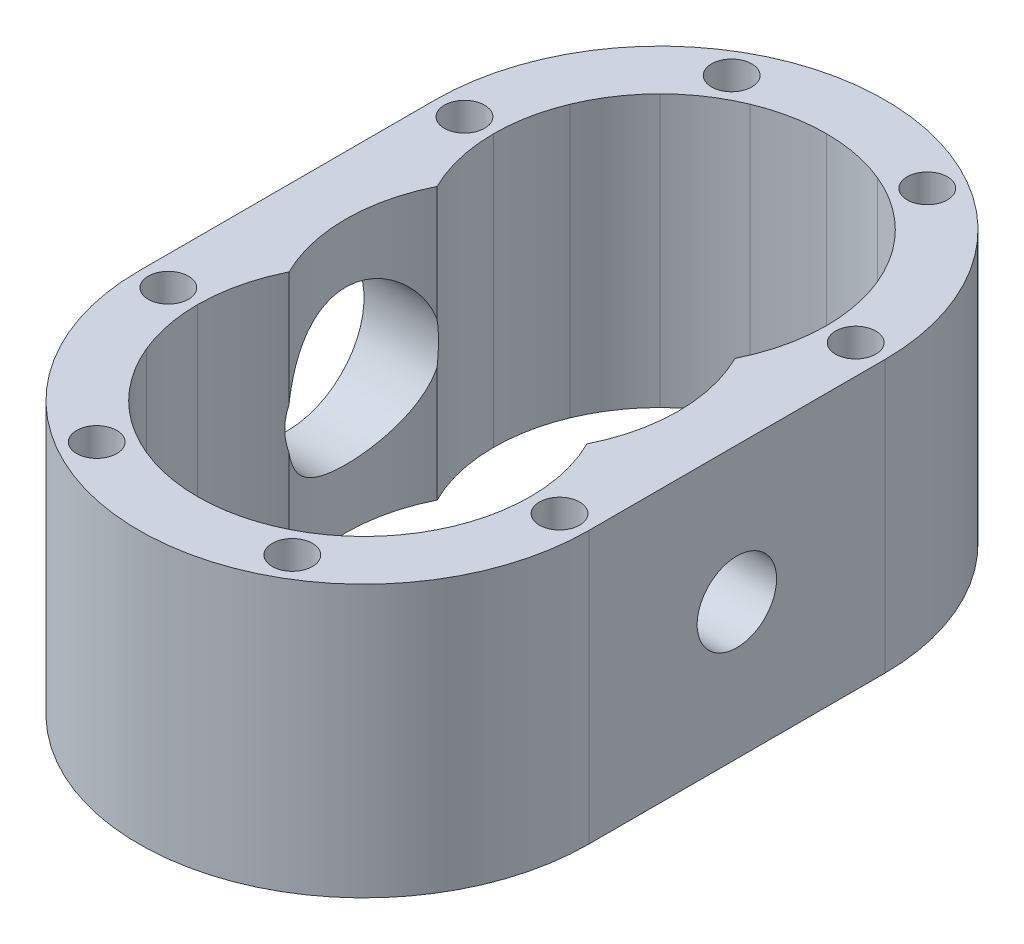
from build123d import *

# Parameters (mm, degrees)
Y_KSEKLIK_EKSTR_ZYON1_DEPTH = 37.15
KES_EKSTR_ZYON1_DEPTH       = 74.3
IZIM3_R                     = 5.5
KES_EKSTR_ZYON2_DEPTH       = 12
DAIRESEL_KAPLAMA1_COUNT     = 5
DAIRESEL_KAPLAMA1_ANGLE     = 240
AYNALAMA1_COPY_1_SKETCH_R   = 5.5
AYNALAMA1_COPY_1_DEPTH      = 12
AYNALAMA1_COPY_2_SKETCH_R   = 5.5
AYNALAMA1_COPY_2_DEPTH      = 12
AYNALAMA1_COPY_3_SKETCH_R   = 5.5
AYNALAMA1_COPY_3_DEPTH      = 12
AYNALAMA1_COPY_4_SKETCH_R   = 5.5
AYNALAMA1_COPY_4_DEPTH      = 12
AYNALAMA2_COPY_1_SKETCH_R   = 5.5
AYNALAMA2_COPY_1_DEPTH      = 12
AYNALAMA2_COPY_2_SKETCH_R   = 5.5
AYNALAMA2_COPY_2_DEPTH      = 12
AYNALAMA2_COPY_3_SKETCH_R   = 5.5
AYNALAMA2_COPY_3_DEPTH      = 12
AYNALAMA2_COPY_4_SKETCH_R   = 5.5
AYNALAMA2_COPY_4_DEPTH      = 12
AYNALAMA2_COPY_5_SKETCH_R   = 5.5
AYNALAMA2_COPY_5_DEPTH      = 12
AYNALAMA2_COPY_6_SKETCH_R   = 5.5
AYNALAMA2_COPY_6_DEPTH      = 12
AYNALAMA2_COPY_7_SKETCH_R   = 5.5
AYNALAMA2_COPY_7_DEPTH      = 12
AYNALAMA2_COPY_8_SKETCH_R   = 5.5
AYNALAMA2_COPY_8_DEPTH      = 12
AYNALAMA2_COPY_9_SKETCH_R   = 5.5
AYNALAMA2_COPY_9_DEPTH      = 12
KES_EKSTR_ZYON3_REACH       = 166.052
KES_EKSTR_ZYON3_END_RADIUS  = 45.5
IZIM4_R                     = 21.03
KES_EKSTR_ZYON4_REACH       = 166.052
KES_EKSTR_ZYON4_END_RADIUS  = 45.5
IZIM5_R                     = 10.86


with BuildPart() as part:
    # Çizim1 → Yükseklik-Ekstrüzyon1 (new, symmetric)
    with BuildSketch(Plane(origin=(0, 0, 0), x_dir=(1, 0, 0), z_dir=(0, 1, 0))):
        with BuildLine():
            Line((61.5, 40.5), (61.5, -40.5))
            ThreePointArc((61.5, -40.5), (0, -102), (-61.5, -40.5))
            Line((-61.5, -40.5), (-61.5, 40.5))
            ThreePointArc((-61.5, 40.5), (0, 102), (61.5, 40.5))
        make_face()
    extrude(amount=Y_KSEKLIK_EKSTR_ZYON1_DEPTH, both=True)

    # Çizim2 → Kes-Ekstrüzyon1 (cut)
    with BuildSketch(Plane(origin=(0, 37.15, 0), x_dir=(1, 0, 0), z_dir=(0, 1, 0))):
        with BuildLine():
            ThreePointArc((40.745398513, 20.25), (0, 86), (-40.745398513, 20.25))
            ThreePointArc((-40.745398513, 20.25), (-45.5, 0), (-40.745398513, -20.25))
            ThreePointArc((-40.745398513, -20.25), (0, -86), (40.745398513, -20.25))
            ThreePointArc((40.745398513, -20.25), (45.5, 0), (40.745398513, 20.25))
        make_face()
    extrude(amount=-KES_EKSTR_ZYON1_DEPTH, mode=Mode.SUBTRACT)

    # Çizim3 → Kes-Ekstrüzyon2 (cut)
    with BuildSketch(Plane(origin=(0, 37.15, 0), x_dir=(1, 0, 0), z_dir=(0, 1, 0))):
        with Locations(Location((-53.5, 40.5, 0), (0, 0, 270))):
            Circle(IZIM3_R)
    kes_ekstr_zyon2 = extrude(amount=-KES_EKSTR_ZYON2_DEPTH, mode=Mode.SUBTRACT)

    # Dairesel Kaplama1: Kes-Ekstrüzyon2 ×5 about axis
    dairesel_kaplama1_axis = Axis((0, 0, -40.5), (0, -1, 0))
    for i in range(1, DAIRESEL_KAPLAMA1_COUNT):
        add(kes_ekstr_zyon2.rotate(dairesel_kaplama1_axis, i * DAIRESEL_KAPLAMA1_ANGLE / (DAIRESEL_KAPLAMA1_COUNT - 1)), mode=Mode.SUBTRACT)

    # Aynalama1: Kes-Ekstrüzyon2 across plane
    add(kes_ekstr_zyon2.mirror(Plane.XY), mode=Mode.SUBTRACT)

    # Aynalama1 copy 1 sketch → Aynalama1 copy 1 (cut)
    with BuildSketch(Plane(origin=(-35.074028853, 37.15, 20.25), x_dir=(0.4999999999999978, 0, -0.8660254037844399), z_dir=(0, 1, 0))):
        with Locations((-53.5, -40.5)):
            Circle(AYNALAMA1_COPY_1_SKETCH_R)
    extrude(amount=-AYNALAMA1_COPY_1_DEPTH, mode=Mode.SUBTRACT)

    # Aynalama1 copy 2 sketch → Aynalama1 copy 2 (cut)
    with BuildSketch(Plane(origin=(-35.074028853, 37.15, 60.75), x_dir=(-0.5000000000000044, 0, -0.866025403784436), z_dir=(0, 1, 0))):
        with Locations((-53.5, -40.5)):
            Circle(AYNALAMA1_COPY_2_SKETCH_R)
    extrude(amount=-AYNALAMA1_COPY_2_DEPTH, mode=Mode.SUBTRACT)

    # Aynalama1 copy 3 sketch → Aynalama1 copy 3 (cut)
    with BuildSketch(Plane(origin=(0, 37.15, 81), x_dir=(-1, 0, 0), z_dir=(0, 1, 0))):
        with Locations((-53.5, -40.5)):
            Circle(AYNALAMA1_COPY_3_SKETCH_R)
    extrude(amount=-AYNALAMA1_COPY_3_DEPTH, mode=Mode.SUBTRACT)

    # Aynalama1 copy 4 sketch → Aynalama1 copy 4 (cut)
    with BuildSketch(Plane(origin=(35.074028853, 37.15, 60.75), x_dir=(-0.4999999999999912, 0, 0.8660254037844437), z_dir=(0, 1, 0))):
        with Locations((-53.5, -40.5)):
            Circle(AYNALAMA1_COPY_4_SKETCH_R)
    extrude(amount=-AYNALAMA1_COPY_4_DEPTH, mode=Mode.SUBTRACT)

    # Aynalama2: Kes-Ekstrüzyon2 across plane
    add(kes_ekstr_zyon2.mirror(Plane.ZX), mode=Mode.SUBTRACT)

    # Aynalama2 copy 1 sketch → Aynalama2 copy 1 (cut)
    with BuildSketch(Plane(origin=(-35.074028853, -37.15, -20.25), x_dir=(0.4999999999999978, 0, 0.8660254037844399), z_dir=(0, -1, 0))):
        with Locations((-53.5, -40.5)):
            Circle(AYNALAMA2_COPY_1_SKETCH_R)
    extrude(amount=-AYNALAMA2_COPY_1_DEPTH, mode=Mode.SUBTRACT)

    # Aynalama2 copy 2 sketch → Aynalama2 copy 2 (cut)
    with BuildSketch(Plane(origin=(-35.074028853, -37.15, -60.75), x_dir=(-0.5000000000000044, 0, 0.866025403784436), z_dir=(0, -1, 0))):
        with Locations((-53.5, -40.5)):
            Circle(AYNALAMA2_COPY_2_SKETCH_R)
    extrude(amount=-AYNALAMA2_COPY_2_DEPTH, mode=Mode.SUBTRACT)

    # Aynalama2 copy 3 sketch → Aynalama2 copy 3 (cut)
    with BuildSketch(Plane(origin=(0, -37.15, -81), x_dir=(-1, 0, 0), z_dir=(0, -1, 0))):
        with Locations((-53.5, -40.5)):
            Circle(AYNALAMA2_COPY_3_SKETCH_R)
    extrude(amount=-AYNALAMA2_COPY_3_DEPTH, mode=Mode.SUBTRACT)

    # Aynalama2 copy 4 sketch → Aynalama2 copy 4 (cut)
    with BuildSketch(Plane(origin=(35.074028853, -37.15, -60.75), x_dir=(-0.4999999999999912, 0, -0.8660254037844437), z_dir=(0, -1, 0))):
        with Locations((-53.5, -40.5)):
            Circle(AYNALAMA2_COPY_4_SKETCH_R)
    extrude(amount=-AYNALAMA2_COPY_4_DEPTH, mode=Mode.SUBTRACT)

    # Aynalama2 copy 5 sketch → Aynalama2 copy 5 (cut)
    with BuildSketch(Plane.XZ.offset(37.15)):
        with Locations(Location((-53.5, 40.5, 0), (0, 0, 270))):
            Circle(AYNALAMA2_COPY_5_SKETCH_R)
    extrude(amount=-AYNALAMA2_COPY_5_DEPTH, mode=Mode.SUBTRACT)

    # Aynalama2 copy 6 sketch → Aynalama2 copy 6 (cut)
    with BuildSketch(Plane(origin=(-35.074028853, -37.15, 20.25), x_dir=(0.4999999999999978, 0, -0.8660254037844399), z_dir=(0, -1, 0))):
        with Locations(Location((-53.5, 40.5, 0), (0, 0, 270))):
            Circle(AYNALAMA2_COPY_6_SKETCH_R)
    extrude(amount=-AYNALAMA2_COPY_6_DEPTH, mode=Mode.SUBTRACT)

    # Aynalama2 copy 7 sketch → Aynalama2 copy 7 (cut)
    with BuildSketch(Plane(origin=(-35.074028853, -37.15, 60.75), x_dir=(-0.5000000000000044, 0, -0.866025403784436), z_dir=(0, -1, 0))):
        with Locations(Location((-53.5, 40.5, 0), (0, 0, 270))):
            Circle(AYNALAMA2_COPY_7_SKETCH_R)
    extrude(amount=-AYNALAMA2_COPY_7_DEPTH, mode=Mode.SUBTRACT)

    # Aynalama2 copy 8 sketch → Aynalama2 copy 8 (cut)
    with BuildSketch(Plane(origin=(0, -37.15, 81), x_dir=(-1, 0, 0), z_dir=(0, -1, 0))):
        with Locations(Location((-53.5, 40.5, 0), (0, 0, 270))):
            Circle(AYNALAMA2_COPY_8_SKETCH_R)
    extrude(amount=-AYNALAMA2_COPY_8_DEPTH, mode=Mode.SUBTRACT)

    # Aynalama2 copy 9 sketch → Aynalama2 copy 9 (cut)
    with BuildSketch(Plane(origin=(35.074028853, -37.15, 60.75), x_dir=(-0.4999999999999912, 0, 0.8660254037844437), z_dir=(0, -1, 0))):
        with Locations(Location((-53.5, 40.5, 0), (0, 0, 270))):
            Circle(AYNALAMA2_COPY_9_SKETCH_R)
    extrude(amount=-AYNALAMA2_COPY_9_DEPTH, mode=Mode.SUBTRACT)

    # Kes-Ekstrüzyon3: up to this cylinder (the profile starts outside it)
    kes_ekstr_zyon3_end = Plane(origin=(0, 0, 0), z_dir=(0, 1, 0)) * Cylinder(KES_EKSTR_ZYON3_END_RADIUS, 424.104, mode=Mode.PRIVATE)
    # Çizim4 → Kes-Ekstrüzyon3 (cut, up to the surface)
    with BuildSketch(Plane.ZY.offset(61.5), mode=Mode.PRIVATE) as kes_ekstr_zyon3_sk1:
        Circle(IZIM4_R)
    kes_ekstr_zyon3_tool1 = extrude(kes_ekstr_zyon3_sk1.sketch, amount=-KES_EKSTR_ZYON3_REACH, mode=Mode.PRIVATE) - kes_ekstr_zyon3_end
    add(kes_ekstr_zyon3_tool1.solids().sort_by_distance((-61.5, 0, 0))[0], mode=Mode.SUBTRACT)

    # Kes-Ekstrüzyon4: up to this cylinder (the profile starts outside it)
    kes_ekstr_zyon4_end = Plane(origin=(0, 0, 0), z_dir=(0, 1, 0)) * Cylinder(KES_EKSTR_ZYON4_END_RADIUS, 424.104, mode=Mode.PRIVATE)
    # Çizim5 → Kes-Ekstrüzyon4 (cut, up to the surface)
    with BuildSketch(Plane(origin=(61.5, 0, 0), x_dir=(0, 0, -1), z_dir=(1, 0, 0)), mode=Mode.PRIVATE) as kes_ekstr_zyon4_sk1:
        Circle(IZIM5_R)
    kes_ekstr_zyon4_tool1 = extrude(kes_ekstr_zyon4_sk1.sketch, amount=-KES_EKSTR_ZYON4_REACH, mode=Mode.PRIVATE) - kes_ekstr_zyon4_end
    add(kes_ekstr_zyon4_tool1.solids().sort_by_distance((61.5, 0, 0))[0], mode=Mode.SUBTRACT)


solid = part.part
